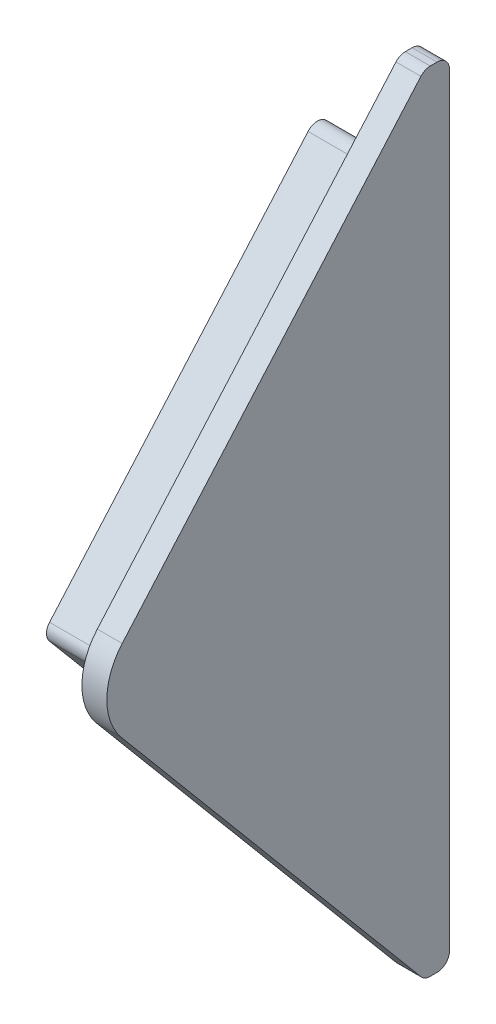
from build123d import *

# Parameters (mm, degrees)
BOSS_EXTRUDE1_DEPTH = 5
BOSS_EXTRUDE2_DEPTH = 2
FILLET1_R           = 5
FILLET2_R           = 1
FILLET3_R           = 1


with BuildPart() as part:
    # Sketch32 → Boss-Extrude1 (new body)
    with BuildSketch(Plane(origin=(0, 0, 0), x_dir=(0, 0, -1), z_dir=(1, 0, 0))):
        Polygon((-23.663373299, 32.245792092), (-0.6, 4.759934105), (-0.6, 58.641752364), align=None)
    extrude(amount=-BOSS_EXTRUDE1_DEPTH)

    # Sketch33 → Boss-Extrude2 (add)
    with BuildSketch(Plane(origin=(0, 0, 0), x_dir=(0, 0, -1), z_dir=(1, 0, 0))):
        Polygon((0, 0), (2, 0), (2, 63.28), (0, 63.28), (-27.086136094, 32.28), align=None)
    extrude(amount=BOSS_EXTRUDE2_DEPTH)

    # Fillet1
    fillet1_edges = [part.edges().sort_by_distance(p)[0] for p in [
        (1, 32.28, 27.086136094),
    ]]
    fillet(fillet1_edges, radius=FILLET1_R)

    # Fillet2
    fillet2_edges = [part.edges().sort_by_distance(p)[0] for p in [
        (-2.5, 32.245792092, 23.663373299),
        (-2.5, 58.641752364, 0.6),
        (-2.5, 4.759934105, 0.6),
    ]]
    fillet(fillet2_edges, radius=FILLET2_R)

    # Fillet3
    fillet3_edges = [part.edges().sort_by_distance(p)[0] for p in [
        (1, 0, 0),
        (1, 0, -2),
        (1, 63.28, -2),
        (1, 63.28, 0),
    ]]
    fillet(fillet3_edges, radius=FILLET3_R)


solid = part.part
